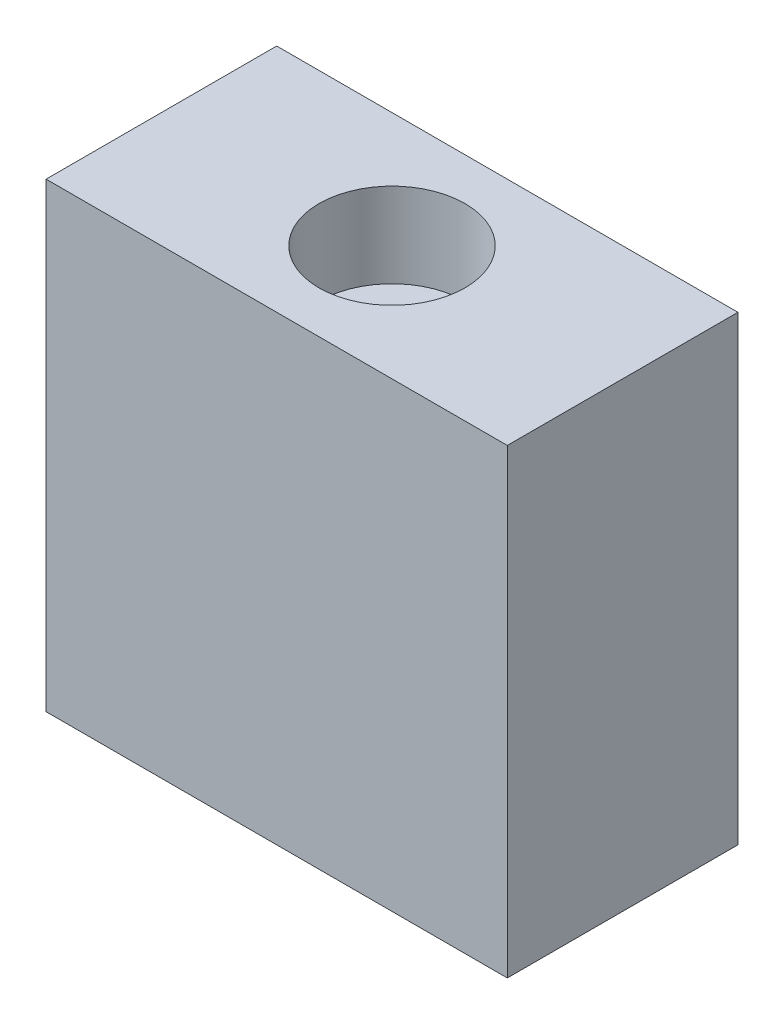
from build123d import *

# Parameters (mm, degrees)
SKETCH1_W               = 30
SKETCH1_H               = 15
BOSS_EXTRUDE1_DEPTH     = 30
CUT_EXTRUDE1_DEPTH      = 35.369317712
CUT_EXTRUDE1_DEPTH_BACK = 35.369317712
SKETCH2_R               = 2.75
SKETCH3_R               = 4.75
CUT_EXTRUDE3_DEPTH      = 5.5


with BuildPart() as part:
    # Sketch1 → Boss-Extrude1 (new body)
    with BuildSketch(Plane(origin=(0, 0, 0), x_dir=(1, 0, 0), z_dir=(0, 1, 0))):
        Rectangle(SKETCH1_W, SKETCH1_H)
    extrude(amount=BOSS_EXTRUDE1_DEPTH)

    # Sketch2 → Cut-Extrude1 (cut, two sides: drawn at the far end of the back side and taken through both)
    with BuildSketch(Plane(origin=(0, 0, 0), x_dir=(1, 0, 0), z_dir=(0, 1, 0)).offset(-CUT_EXTRUDE1_DEPTH_BACK)):
        with Locations(Location((0, 0, 0), (0, 0, 270))):
            Circle(SKETCH2_R)
    extrude(amount=CUT_EXTRUDE1_DEPTH + CUT_EXTRUDE1_DEPTH_BACK, mode=Mode.SUBTRACT)

    # Sketch3 → Cut-Extrude3 (cut)
    with BuildSketch(Plane(origin=(0, 30, 0), x_dir=(1, 0, 0), z_dir=(0, 1, 0))):
        with Locations(Location((0, 0, 0), (0, 0, 270))):
            Circle(SKETCH3_R)
    extrude(amount=-CUT_EXTRUDE3_DEPTH, mode=Mode.SUBTRACT)


solid = part.part
